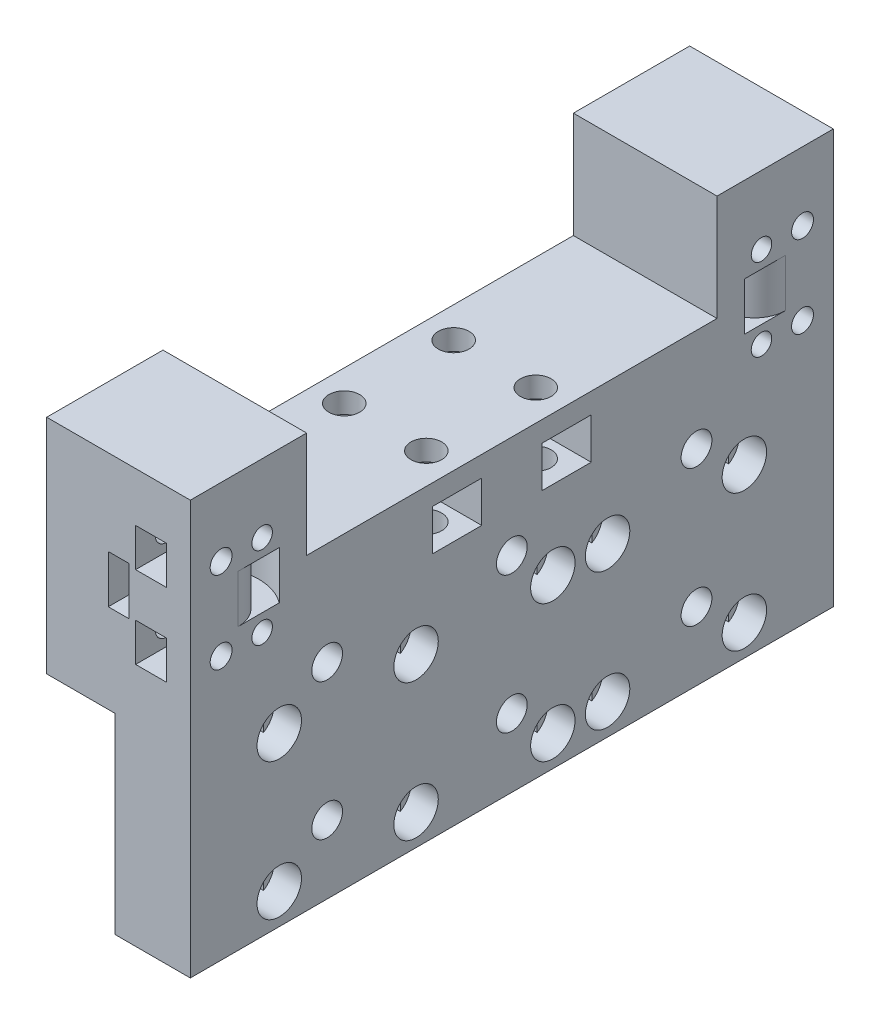
from build123d import *

# Parameters (mm, degrees)
BOSS_EXTRUDE1_DEPTH                                 = 47
CBORE_FOR_M3_HEX_SOCKET_HEAD_CAP_SCREW1_D           = 3.4
CBORE_FOR_M3_HEX_SOCKET_HEAD_CAP_SCREW1_CBORE_D     = 6.5
CBORE_FOR_M3_HEX_SOCKET_HEAD_CAP_SCREW1_CBORE_DEPTH = 4
SKETCH4_W                                           = 3
SKETCH4_H                                           = 7
SKETCH8_R                                           = 1.6
CUT_EXTRUDE1_DEPTH                                  = 12
CUT_EXTRUDE2_START                                  = -3.5
CUT_EXTRUDE2_DEPTH                                  = 4.5
SKETCH11_W                                          = 60
SKETCH11_H                                          = 15.5
CUT_EXTRUDE3_DEPTH                                  = 80.437082021
SKETCH12_R                                          = 1.5
CUT_EXTRUDE4_DEPTH                                  = 8
SKETCH13_R                                          = 2.25
CUT_EXTRUDE5_DEPTH                                  = 14
CUT_EXTRUDE6_START                                  = -3
CUT_EXTRUDE6_DEPTH                                  = 6
SKETCH15_R                                          = 2.25
CUT_EXTRUDE7_DEPTH                                  = 80.437082021
CUT_EXTRUDE8_START                                  = -4
CUT_EXTRUDE8_DEPTH                                  = 76.437082021
CUT_EXTRUDE9_DEPTH                                  = 0.5


with BuildPart() as part:
    # Sketch1 → Boss-Extrude1 (new, symmetric)
    with BuildSketch(Plane.XY):
        Polygon((0, 0), (11, 0), (11, 60.5), (-10, 60.5), (-10, 28), (0, 28), align=None)
    extrude(amount=BOSS_EXTRUDE1_DEPTH, both=True)

    # CBORE for M3 Hex Socket Head Cap Screw1 (through all)
    with Locations(Plane(origin=(11, 0, 0), x_dir=(0, 0, -1), z_dir=(1, 0, 0))):
        with Locations((-34, 4.5), (-34, 24.5), (-14, 24.5), (-14, 4.5), (14, 24.5), (34, 24.5), (14, 4.5), (34, 4.5), (6, 24.5), (6, 4.5)):
            CounterBoreHole(CBORE_FOR_M3_HEX_SOCKET_HEAD_CAP_SCREW1_D / 2, CBORE_FOR_M3_HEX_SOCKET_HEAD_CAP_SCREW1_CBORE_D / 2, CBORE_FOR_M3_HEX_SOCKET_HEAD_CAP_SCREW1_CBORE_DEPTH)

    # Cut-Sweep1: sweep along a path in Sketch7
    with BuildLine(Plane(origin=(0, 44.5, 0), x_dir=(1, 0, 0), z_dir=(0, 1, 0))) as cut_sweep1_path:
        Line((0.5, -47), (0.5, -40))
        ThreePointArc((0.5, -40), (6.5, -34), (12.5, -40))
    # Sketch4 → Cut-Sweep1 (sweep, cut)
    with BuildSketch(Plane.XY.offset(47)):
        with Locations((0.5, 44.5)):
            Rectangle(SKETCH4_W, SKETCH4_H)
    cut_sweep1 = sweep(path=cut_sweep1_path.line, mode=Mode.SUBTRACT)

    # Sketch8 → Cut-Extrude1 (cut)
    with BuildSketch(Plane(origin=(11, 0, 0), x_dir=(0, 0, -1), z_dir=(1, 0, 0))):
        with Locations((-42.5, 50.5)):
            Circle(SKETCH8_R)
        with Locations((-42.5, 38.5)):
            Circle(SKETCH8_R)
    cut_extrude1 = extrude(amount=-CUT_EXTRUDE1_DEPTH, mode=Mode.SUBTRACT)

    # Sketch10 → Cut-Extrude2 (cut)
    with BuildSketch(Plane(origin=(11, 0, 0), x_dir=(0, 0, -1), z_dir=(1, 0, 0)).offset(CUT_EXTRUDE2_START)):
        Polygon((-44.116580754, 41.3), (-47, 41.3), (-47, 35.7), (-44.116580754, 35.7), (-40.883419246, 35.7), (-40.483419246, 35.7), (-38.866838493, 38.5), (-40.483419246, 41.3), (-40.883419246, 41.3), align=None)
        Polygon((-40.483419246, 47.7), (-40.883419246, 47.7), (-44.116580754, 47.7), (-47, 47.7), (-47, 53.3), (-44.116580754, 53.3), (-40.883419246, 53.3), (-40.483419246, 53.3), (-38.866838493, 50.5), align=None)
    cut_extrude2 = extrude(amount=-CUT_EXTRUDE2_DEPTH, mode=Mode.SUBTRACT)

    # Mirror1: Cut-Sweep1, Cut-Extrude1, Cut-Extrude2 across plane
    add(cut_sweep1.mirror(Plane.XY), mode=Mode.SUBTRACT)
    add(cut_extrude1.mirror(Plane.XY), mode=Mode.SUBTRACT)
    add(cut_extrude2.mirror(Plane.XY), mode=Mode.SUBTRACT)

    # Sketch11 → Cut-Extrude3 (cut, through all)
    with BuildSketch(Plane(origin=(11, 0, 0), x_dir=(0, 0, -1), z_dir=(1, 0, 0))):
        with Locations((0, 52.75)):
            Rectangle(SKETCH11_W, SKETCH11_H)
    extrude(amount=-CUT_EXTRUDE3_DEPTH, mode=Mode.SUBTRACT)

    # Sketch12 → Cut-Extrude4 (cut)
    with BuildSketch(Plane(origin=(11, 0, 0), x_dir=(0, 0, -1), z_dir=(1, 0, 0))):
        with Locations((-36.5, 50.5)):
            Circle(SKETCH12_R)
        with Locations((-36.5, 38.5)):
            Circle(SKETCH12_R)
        with Locations(Location((36.5, 38.5, 0), (0, 0, 180))):
            Circle(SKETCH12_R)
        with Locations(Location((36.5, 50.5, 0), (0, 0, 180))):
            Circle(SKETCH12_R)
    extrude(amount=-CUT_EXTRUDE4_DEPTH, mode=Mode.SUBTRACT)

    # Sketch13 → Cut-Extrude5 (cut)
    with BuildSketch(Plane(origin=(0, 45, 0), x_dir=(1, 0, 0), z_dir=(0, 1, 0))):
        with Locations(Location((-5.5, 8, 0), (0, 0, 270))):
            Circle(SKETCH13_R)
        with Locations(Location((6.5, 8, 0), (0, 0, 270))):
            Circle(SKETCH13_R)
        with Locations(Location((6.5, -8, 0), (0, 0, 270))):
            Circle(SKETCH13_R)
        with Locations(Location((-5.5, -8, 0), (0, 0, 270))):
            Circle(SKETCH13_R)
    extrude(amount=-CUT_EXTRUDE5_DEPTH, mode=Mode.SUBTRACT)

    # Sketch14 → Cut-Extrude6 (cut)
    with BuildSketch(Plane(origin=(0, 45, 0), x_dir=(1, 0, 0), z_dir=(0, 1, 0)).offset(CUT_EXTRUDE6_START)):
        Polygon((-7.578460969, 11.6), (-10, 11.6), (-10, 4.4), (-7.578460969, 4.4), (-3.421539031, 4.4), (-1.343078062, 8), (-3.421539031, 11.6), align=None)
        Polygon((11, 4.4), (8.578460969, 4.4), (4.421539031, 4.4), (2.343078062, 8), (4.421539031, 11.6), (8.578460969, 11.6), (11, 11.6), align=None)
        Polygon((8.578460969, -11.6), (11, -11.6), (11, -4.4), (8.578460969, -4.4), (4.421539031, -4.4), (2.343078062, -8), (4.421539031, -11.6), align=None)
        Polygon((-10, -4.4), (-7.578460969, -4.4), (-3.421539031, -4.4), (-1.343078062, -8), (-3.421539031, -11.6), (-7.578460969, -11.6), (-10, -11.6), align=None)
    extrude(amount=-CUT_EXTRUDE6_DEPTH, mode=Mode.SUBTRACT)

    # Sketch15 → Cut-Extrude7 (cut, through all)
    with BuildSketch(Plane(origin=(11, 0, 0), x_dir=(0, 0, -1), z_dir=(1, 0, 0))):
        with Locations((-27, 30)):
            Circle(SKETCH15_R)
        with Locations((-27, 10)):
            Circle(SKETCH15_R)
        with Locations((0, 10)):
            Circle(SKETCH15_R)
        with Locations((0, 30)):
            Circle(SKETCH15_R)
        with Locations((27, 10)):
            Circle(SKETCH15_R)
        with Locations(Location((27, 30, 0), (0, 0, 297.266044451))):
            Circle(SKETCH15_R)
    extrude(amount=-CUT_EXTRUDE7_DEPTH, mode=Mode.SUBTRACT)

    # Sketch16 → Cut-Extrude8 (cut, through all)
    with BuildSketch(Plane(origin=(11, 0, 0), x_dir=(0, 0, -1), z_dir=(1, 0, 0)).offset(CUT_EXTRUDE8_START)):
        Polygon((-27, 25.900813089), (-23.45, 27.950406544), (-23.45, 32.049593456), (-27, 34.099186911), (-30.55, 32.049593456), (-30.55, 27.950406544), align=None)
        Polygon((-27, 5.900813089), (-23.45, 7.950406544), (-23.45, 12.049593456), (-27, 14.099186911), (-30.55, 12.049593456), (-30.55, 7.950406544), align=None)
        Polygon((0, 25.900813089), (3.55, 27.950406544), (3.55, 32.049593456), (0, 34.099186911), (-3.55, 32.049593456), (-3.55, 27.950406544), align=None)
        Polygon((0, 14.099186911), (-3.55, 12.049593456), (-3.55, 7.950406544), (0, 5.900813089), (3.55, 7.950406544), (3.55, 12.049593456), align=None)
        Polygon((27, 25.900813089), (30.55, 27.950406544), (30.55, 32.049593456), (27, 34.099186911), (23.45, 32.049593456), (23.45, 27.950406544), align=None)
        Polygon((27, 14.099186911), (23.45, 12.049593456), (23.45, 7.950406544), (27, 5.900813089), (30.55, 7.950406544), (30.55, 12.049593456), align=None)
    extrude(amount=-CUT_EXTRUDE8_DEPTH, mode=Mode.SUBTRACT)

    # Sketch17 → Cut-Extrude9 (cut)
    with BuildSketch(Plane(origin=(7, 0, 0), x_dir=(0, 0, -1), z_dir=(1, 0, 0))):
        with BuildLine():
            Line((-35.7, 27.269927797), (-35.7, 21.730072203))
            ThreePointArc((-35.7, 21.730072203), (-34, 21.25), (-32.3, 21.730072203))
            Line((-32.3, 21.730072203), (-32.3, 27.269927797))
            ThreePointArc((-32.3, 27.269927797), (-34, 27.75), (-35.7, 27.269927797))
        make_face()
        with BuildLine():
            Line((-15.7, 27.269927797), (-15.7, 21.730072203))
            ThreePointArc((-15.7, 21.730072203), (-14, 21.25), (-12.3, 21.730072203))
            Line((-12.3, 21.730072203), (-12.3, 27.269927797))
            ThreePointArc((-12.3, 27.269927797), (-14, 27.75), (-15.7, 27.269927797))
        make_face()
        with BuildLine():
            Line((-15.7, 7.269927797), (-15.7, 1.730072203))
            ThreePointArc((-15.7, 1.730072203), (-14, 1.25), (-12.3, 1.730072203))
            Line((-12.3, 1.730072203), (-12.3, 7.269927797))
            ThreePointArc((-12.3, 7.269927797), (-14, 7.75), (-15.7, 7.269927797))
        make_face()
        with BuildLine():
            Line((-35.7, 7.269927797), (-35.7, 1.730072203))
            ThreePointArc((-35.7, 1.730072203), (-34, 1.25), (-32.3, 1.730072203))
            Line((-32.3, 1.730072203), (-32.3, 7.269927797))
            ThreePointArc((-32.3, 7.269927797), (-34, 7.75), (-35.7, 7.269927797))
        make_face()
        with BuildLine():
            Line((32.3, 7.269927797), (32.3, 1.730072203))
            ThreePointArc((32.3, 1.730072203), (34, 1.25), (35.7, 1.730072203))
            Line((35.7, 1.730072203), (35.7, 7.269927797))
            ThreePointArc((35.7, 7.269927797), (34, 7.75), (32.3, 7.269927797))
        make_face()
        with BuildLine():
            Line((12.3, 7.269927797), (12.3, 1.730072203))
            ThreePointArc((12.3, 1.730072203), (14, 1.25), (15.7, 1.730072203))
            Line((15.7, 1.730072203), (15.7, 7.269927797))
            ThreePointArc((15.7, 7.269927797), (14, 7.75), (12.3, 7.269927797))
        make_face()
        with BuildLine():
            Line((12.3, 27.269927797), (12.3, 21.730072203))
            ThreePointArc((12.3, 21.730072203), (14, 21.25), (15.7, 21.730072203))
            Line((15.7, 21.730072203), (15.7, 27.269927797))
            ThreePointArc((15.7, 27.269927797), (14, 27.75), (12.3, 27.269927797))
        make_face()
        with BuildLine():
            Line((32.3, 27.269927797), (32.3, 21.730072203))
            ThreePointArc((32.3, 21.730072203), (34, 21.25), (35.7, 21.730072203))
            Line((35.7, 21.730072203), (35.7, 27.269927797))
            ThreePointArc((35.7, 27.269927797), (34, 27.75), (32.3, 27.269927797))
        make_face()
        with BuildLine():
            Line((4.3, 27.269927797), (4.3, 21.730072203))
            ThreePointArc((4.3, 21.730072203), (6, 21.25), (7.7, 21.730072203))
            Line((7.7, 21.730072203), (7.7, 27.269927797))
            ThreePointArc((7.7, 27.269927797), (6, 27.75), (4.3, 27.269927797))
        make_face()
        with BuildLine():
            Line((4.3, 7.269927797), (4.3, 1.730072203))
            ThreePointArc((4.3, 1.730072203), (6, 1.25), (7.7, 1.730072203))
            Line((7.7, 1.730072203), (7.7, 7.269927797))
            ThreePointArc((7.7, 7.269927797), (6, 7.75), (4.3, 7.269927797))
        make_face()
    extrude(amount=-CUT_EXTRUDE9_DEPTH, mode=Mode.SUBTRACT)


solid = part.part
